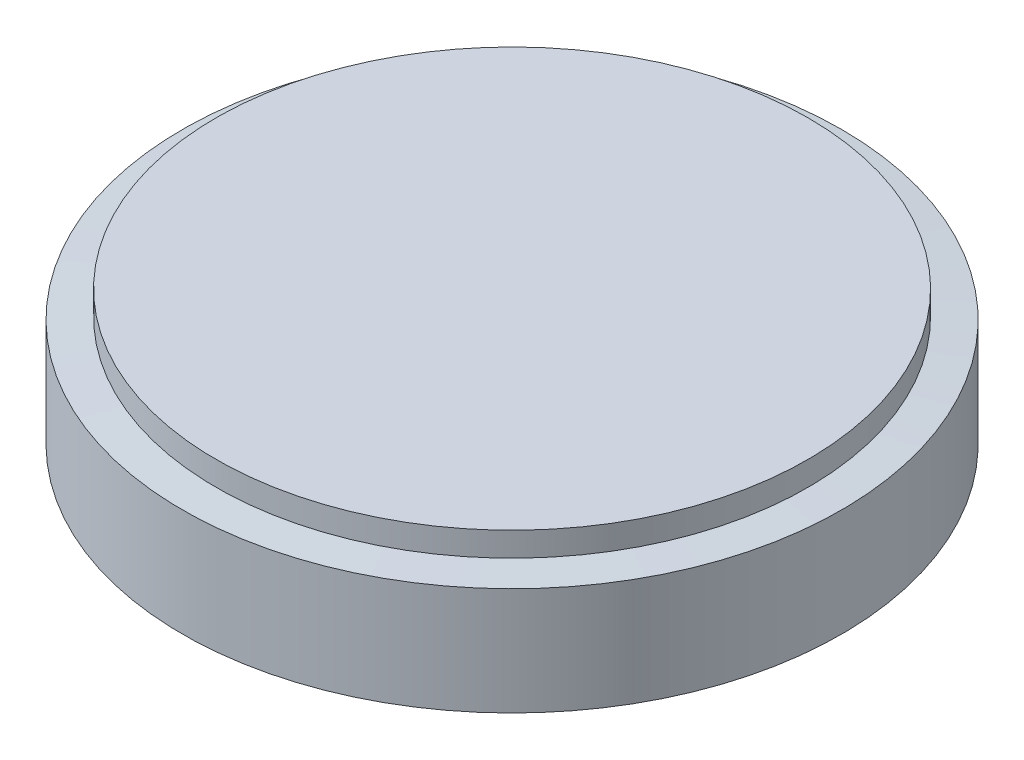
from build123d import *

# Parameters (mm, degrees)
SKETCH_3_W = 11
SKETCH_3_H = 5


with BuildPart() as part:
    # 草图3 → 旋转1 (revolve)
    with BuildSketch(Plane.XY, mode=Mode.PRIVATE) as revolve_1_sk:
        with Locations((-5.5, 2.5)):
            Rectangle(SKETCH_3_W, SKETCH_3_H)
    revolve(revolve_1_sk.sketch.rotate(Axis((0, 0, 0), (0, 1, 0)), 270), axis=Axis((0, 0, 0), (0, 1, 0)))

    # 草图4 → 旋转2 (revolve)
    with BuildSketch(Plane.XY, mode=Mode.PRIVATE) as revolve_2_sk:
        Polygon((-12.25, 0), (-11, 0), (-11, 4.1), (-12.25, 4), align=None)
    revolve(revolve_2_sk.sketch.rotate(Axis((0, 0, 0), (0, 1, 0)), 270), axis=Axis((0, 0, 0), (0, 1, 0)))


solid = part.part
